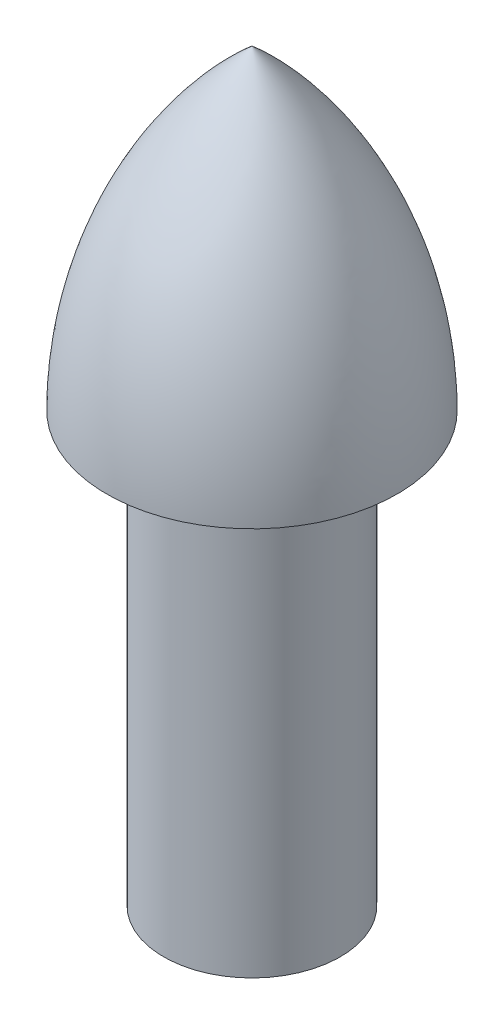
from build123d import *

# Parameters (mm, degrees)
SKETCH_2_R          = 3.5
EXTRUDE_1_DEPTH     = 17
SKETCH_3_R          = 2.25
CUT_EXTRUDE_1_DEPTH = 18


with BuildPart() as part:
    # 草图1 → 旋转1 (revolve)
    with BuildSketch(Plane.XY):
        with BuildLine():
            Line((0, 0), (0, 1))
            Line((0, 1), (4.713145709, 1))
            ThreePointArc((4.713145709, 1), (3.295495491, 6.508537741), (0, 11.144638437))
            Line((0, 11.144638437), (0, 12.5))
            ThreePointArc((0, 12.5), (4.228807467, 6.872751435), (5.75, 0))
            Line((5.75, 0), (0, 0))
        make_face()
    revolve(axis=Axis((0, 11.144638437, 0), (0, 1, 0)))

    # 草图2 → 凸台-拉伸1 (add)
    with BuildSketch(Plane.XZ):
        with Locations(Location((0, 0, 0), (0, 0, 270))):
            Circle(SKETCH_2_R)
    extrude(amount=EXTRUDE_1_DEPTH)

    # 草图3 → 切除-拉伸1 (cut)
    with BuildSketch(Plane.XZ.offset(17)):
        with Locations(Location((0, 0, 0), (0, 0, 270))):
            Circle(SKETCH_3_R)
    extrude(amount=-CUT_EXTRUDE_1_DEPTH, mode=Mode.SUBTRACT)


solid = part.part
